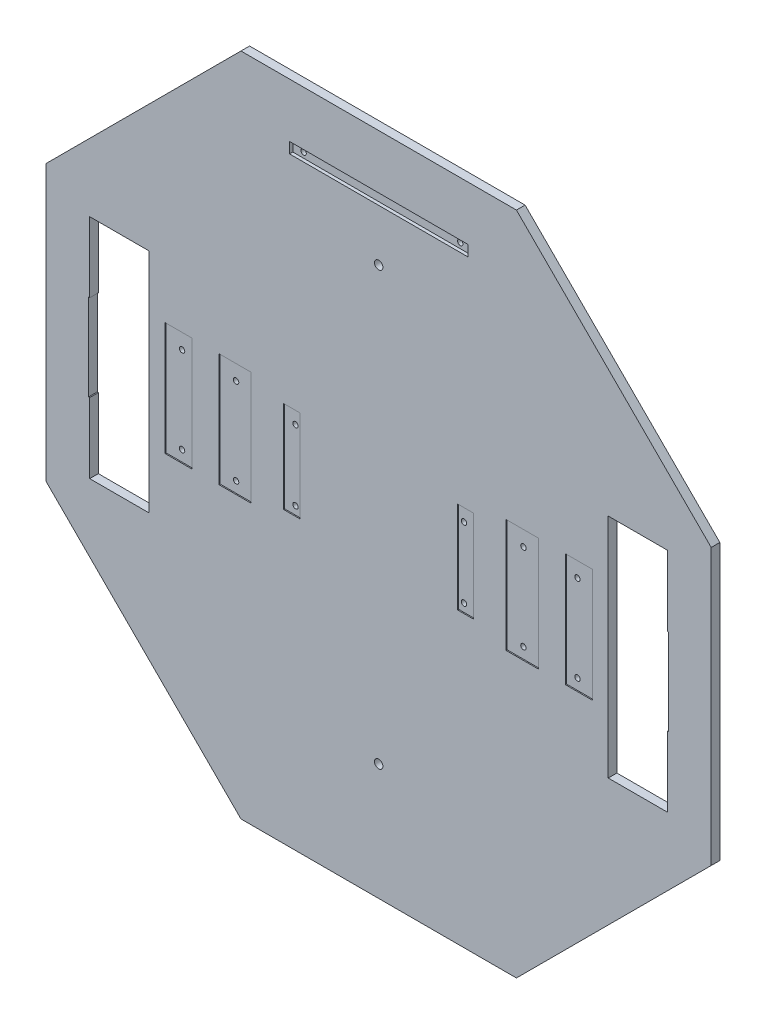
from build123d import *

# Parameters (mm, degrees)
BOSS_EXTRUDE1_DEPTH = 8
SKETCH2_R           = 3.8805
CUT_EXTRUDE1_DEPTH  = 10
SKETCH5_W           = 15
SKETCH5_H           = 85
SKETCH5_R           = 2.5
SKETCH5_W_2         = 25
SKETCH5_H_2         = 105
SKETCH5_W_3         = 30
CUT_EXTRUDE4_DEPTH  = 1
CUT_EXTRUDE7_START  = 91
SKETCH10_R          = 2.5
CUT_EXTRUDE7_DEPTH  = 91
SKETCH12_W          = 165
SKETCH12_H          = 10
SKETCH12_R          = 2
CUT_EXTRUDE11_DEPTH = 3
SKETCH14_R          = 2.5
CUT_EXTRUDE14_DEPTH = 22


with BuildPart() as part:
    # Sketch1 → Boss-Extrude1 (new body)
    with BuildSketch(Plane.XY):
        Polygon((307.812229203, 127.5), (127.5, 307.812229203), (-127.5, 307.812229203), (-307.812229203, 127.5), (-307.812229203, -127.5), (-127.5, -307.812229203), (127.5, -307.812229203), (307.812229203, -127.5), align=None)
    extrude(amount=BOSS_EXTRUDE1_DEPTH)

    # Sketch2 → Cut-Extrude1 (cut)
    with BuildSketch(Plane.XY.offset(8)):
        with Locations((0, 200)):
            Circle(SKETCH2_R)
        with Locations((0, -200)):
            Circle(SKETCH2_R)
        Polygon((212.5, 105), (212.5, -105), (267.5, -105), (267.5, -40), (268.5, -40), (268.5, 0), (268.5, 40), (267.5, 40), (267.5, 105), align=None)
        Polygon((-267.5, 105), (-212.5, 105), (-212.5, -105), (-267.5, -105), (-267.5, -40), (-268.5, -40), (-268.5, 0), (-268.5, 40), (-267.5, 40), align=None)
    extrude(amount=-CUT_EXTRUDE1_DEPTH, mode=Mode.SUBTRACT)

    # Sketch5 → Cut-Extrude4 (cut)
    # profile 1 of 6: a face of its own
    with BuildSketch(Plane.XY.offset(8)):
        with Locations((80.5, 2.5)):
            Rectangle(SKETCH5_W, SKETCH5_H)
        with Locations((78, 32.5)):
            Circle(SKETCH5_R, mode=Mode.SUBTRACT)
        with Locations((78, -32.5)):
            Circle(SKETCH5_R, mode=Mode.SUBTRACT)
    # profile 2 of 6: a face of its own
    with BuildSketch(Plane.XY.offset(8)):
        with Locations((-185.5, 2.5)):
            Rectangle(SKETCH5_W_2, SKETCH5_H_2)
        with Locations((-183, -40)):
            Circle(SKETCH5_R, mode=Mode.SUBTRACT)
        with Locations((-183, 40)):
            Circle(SKETCH5_R, mode=Mode.SUBTRACT)
    # profile 3 of 6: a face of its own
    with BuildSketch(Plane.XY.offset(8)):
        with Locations((-133, 2.5)):
            Rectangle(SKETCH5_W_3, SKETCH5_H_2)
        with Locations((-133, -40)):
            Circle(SKETCH5_R, mode=Mode.SUBTRACT)
        with Locations((-133, 40)):
            Circle(SKETCH5_R, mode=Mode.SUBTRACT)
    # profile 4 of 6: a face of its own
    with BuildSketch(Plane.XY.offset(8)):
        with Locations((-80.5, 2.5)):
            Rectangle(SKETCH5_W, SKETCH5_H)
        with Locations((-78, -32.5)):
            Circle(SKETCH5_R, mode=Mode.SUBTRACT)
        with Locations((-78, 32.5)):
            Circle(SKETCH5_R, mode=Mode.SUBTRACT)
    # profile 5 of 6: a face of its own
    with BuildSketch(Plane.XY.offset(8)):
        with Locations((133, 2.5)):
            Rectangle(SKETCH5_W_3, SKETCH5_H_2)
        with Locations((133, 40)):
            Circle(SKETCH5_R, mode=Mode.SUBTRACT)
        with Locations((133, -40)):
            Circle(SKETCH5_R, mode=Mode.SUBTRACT)
    # profile 6 of 6: a face of its own
    with BuildSketch(Plane.XY.offset(8)):
        with Locations((185.5, 2.5)):
            Rectangle(SKETCH5_W_2, SKETCH5_H_2)
        with Locations((183, 40)):
            Circle(SKETCH5_R, mode=Mode.SUBTRACT)
        with Locations((183, -40)):
            Circle(SKETCH5_R, mode=Mode.SUBTRACT)
    extrude(amount=-CUT_EXTRUDE4_DEPTH, mode=Mode.SUBTRACT)

    # Sketch10 → Cut-Extrude7 (cut)
    with BuildSketch(Plane.XY.offset(CUT_EXTRUDE7_START)):
        with Locations((-183, -40)):
            Circle(SKETCH10_R)
        with Locations((-183, 40)):
            Circle(SKETCH10_R)
        with Locations((-133, -40)):
            Circle(SKETCH10_R)
        with Locations((-133, 40)):
            Circle(SKETCH10_R)
        with Locations((-78, -32.5)):
            Circle(SKETCH10_R)
        with Locations((-78, 32.5)):
            Circle(SKETCH10_R)
        with Locations((78, 32.5)):
            Circle(SKETCH10_R)
        with Locations((78, -32.5)):
            Circle(SKETCH10_R)
        with Locations((133, 40)):
            Circle(SKETCH10_R)
        with Locations((133, -40)):
            Circle(SKETCH10_R)
        with Locations((183, 40)):
            Circle(SKETCH10_R)
        with Locations((183, -40)):
            Circle(SKETCH10_R)
    extrude(amount=-CUT_EXTRUDE7_DEPTH, mode=Mode.SUBTRACT)

    # Sketch12 → Cut-Extrude11 (cut)
    with BuildSketch(Plane.XY.offset(8)):
        with Locations((0, 252.812229203)):
            Rectangle(SKETCH12_W, SKETCH12_H)
        with Locations((-72.5, 252.812229203)):
            Circle(SKETCH12_R, mode=Mode.SUBTRACT)
        with Locations((72.5, 252.812229203)):
            Circle(SKETCH12_R, mode=Mode.SUBTRACT)
    extrude(amount=-CUT_EXTRUDE11_DEPTH, mode=Mode.SUBTRACT)

    # Sketch14 → Cut-Extrude14 (cut)
    with BuildSketch(Plane.XY):
        with Locations((-72.5, 252.812229203)):
            Circle(SKETCH14_R)
        with Locations((72.5, 252.812229203)):
            Circle(SKETCH14_R)
    extrude(amount=CUT_EXTRUDE14_DEPTH, mode=Mode.SUBTRACT)


solid = part.part
